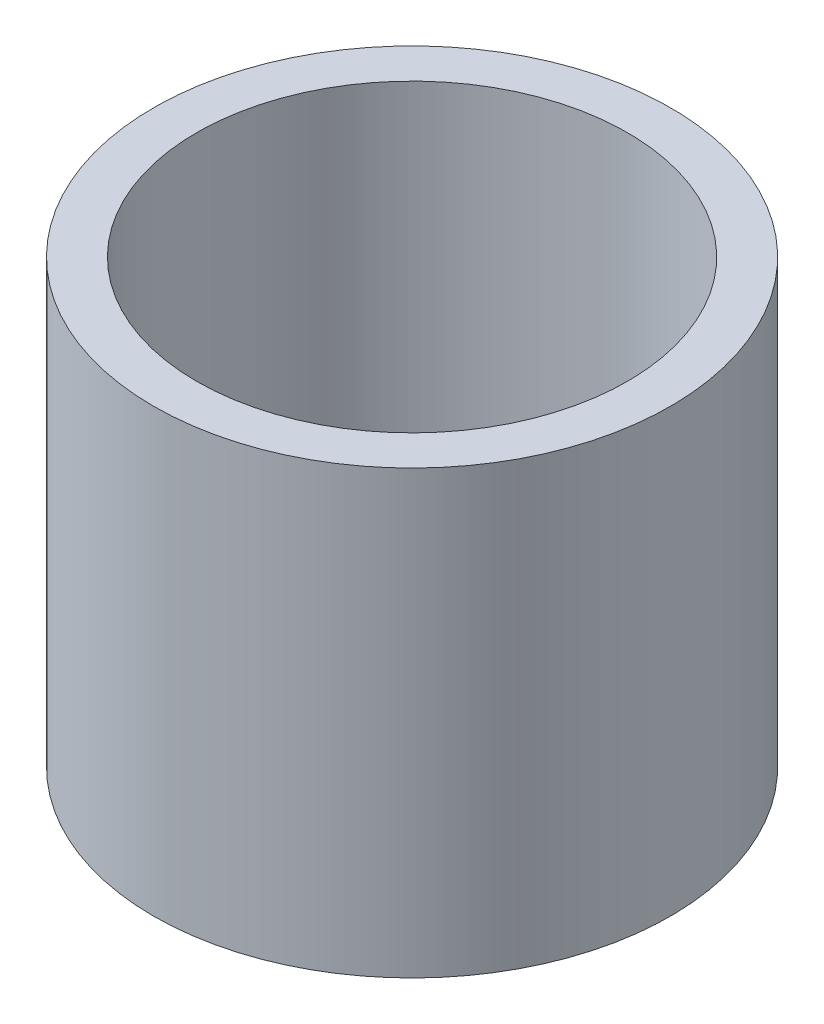
from build123d import *

# Parameters (mm, degrees)
SKETCH1_R           = 12
SKETCH1_R_2         = 10
BOSS_EXTRUDE1_DEPTH = 10.25


with BuildPart() as part:
    # Sketch1 → Boss-Extrude1 (new, symmetric)
    with BuildSketch(Plane(origin=(0, 0, 0), x_dir=(1, 0, 0), z_dir=(0, 1, 0))):
        with Locations(Location((0, 0, 0), (0, 0, 270))):
            Circle(SKETCH1_R)
        with Locations(Location((0, 0, 0), (0, 0, 270))):
            Circle(SKETCH1_R_2, mode=Mode.SUBTRACT)
    extrude(amount=BOSS_EXTRUDE1_DEPTH, both=True)


solid = part.part
